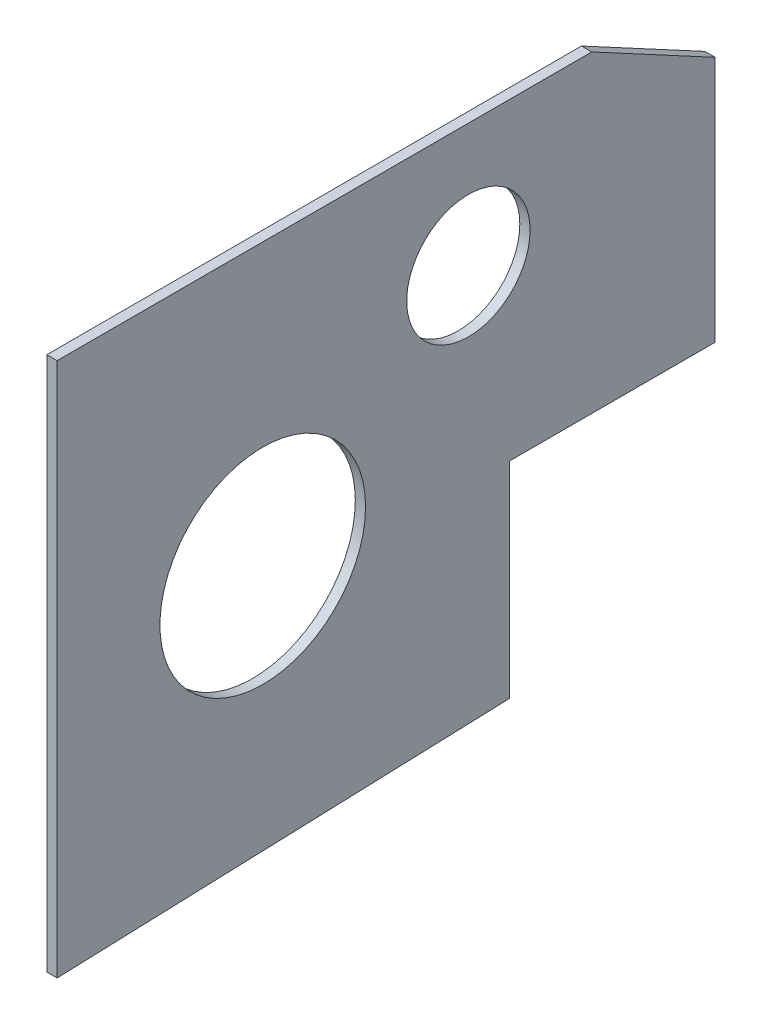
from build123d import *

# Parameters (mm, degrees)
BOSS_EXTRUDE1_DEPTH = 3.175
SKETCH3_R           = 31.75
SKETCH3_R_2         = 19.05
CUT_EXTRUDE3_DEPTH  = 349.186809908


with BuildPart() as part:
    # Sketch2 → Boss-Extrude1 (new body)
    with BuildSketch(Plane(origin=(0, 0, 0), x_dir=(0, 0, -1), z_dir=(1, 0, 0))):
        Polygon((-337.942750929, 83.777509294), (-172.842750929, 83.777509294), (-134.742750929, 63.287546468), (-134.742750929, -12.912453532), (-198.242750929, -12.912453532), (-198.242750929, -76.412453532), (-337.942750929, -81.322490706), align=None)
    extrude(amount=BOSS_EXTRUDE1_DEPTH)

    # Sketch3 → Cut-Extrude3 (cut, through all)
    with BuildSketch(Plane(origin=(3.175, 0, 0), x_dir=(0, 0, -1), z_dir=(1, 0, 0))):
        with Locations((-274.442750929, -2.843604756)):
            Circle(SKETCH3_R)
        with Locations((-210.942750929, 45.677509294)):
            Circle(SKETCH3_R_2)
    extrude(amount=-CUT_EXTRUDE3_DEPTH, mode=Mode.SUBTRACT)


solid = part.part
